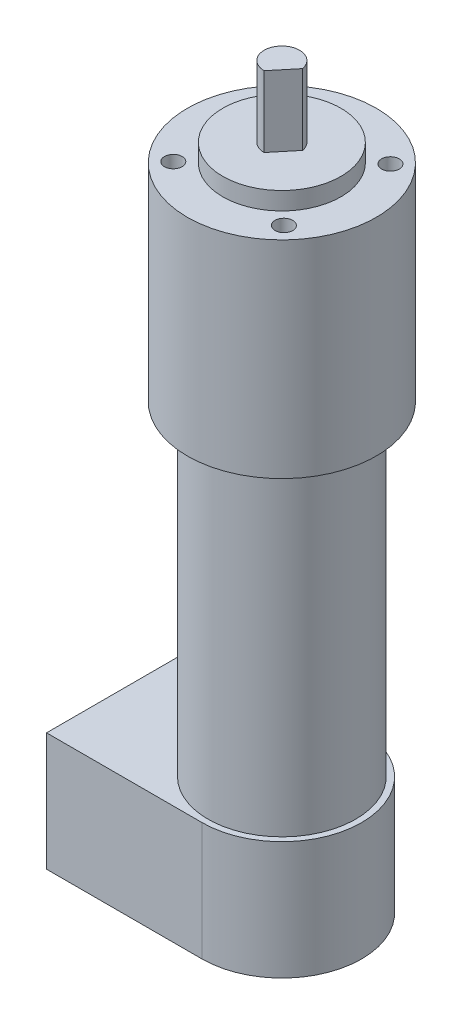
from build123d import *

# Parameters (mm, degrees)
ESQUISSE1_R             = 16
BOSS_EXTRU_1_DEPTH      = 35
ESQUISSE2_R             = 12.5
BOSS_EXTRU_2_DEPTH      = 55
ESQUISSE3_R             = 3
BOSS_EXTRU_3_DEPTH      = 15
ENL_V_START             = -15
ENL_V_MAT_EXTRU_1_DEPTH = 15
ESQUISSE5_R             = 10
BOSS_EXTRU_4_DEPTH      = 3
ESQUISSE8_R             = 1.5
ENL_V_MAT_EXTRU_2_DEPTH = 10
BOSS_EXTRU_5_DEPTH      = 20
ESQUISSE10_W            = 16.98090883
ESQUISSE10_H            = 7.182585406
ENL_V_MAT_EXTRU_3_DEPTH = 12
ESQUISSE12_W            = 1
ESQUISSE12_H            = 1
BOSS_EXTRU_6_DEPTH      = 12


with BuildPart() as part:
    # Esquisse1 → Boss.-Extru.1 (new body)
    with BuildSketch(Plane(origin=(0, 0, 0), x_dir=(1, 0, 0), z_dir=(0, 1, 0))):
        with Locations(Location((0, 0, 0), (0, 0, 270))):
            Circle(ESQUISSE1_R)
    extrude(amount=BOSS_EXTRU_1_DEPTH)

    # Esquisse2 → Boss.-Extru.2 (add)
    with BuildSketch(Plane.XZ):
        with Locations(Location((0, 0, 0), (0, 0, 270))):
            Circle(ESQUISSE2_R)
    extrude(amount=BOSS_EXTRU_2_DEPTH)

    # Esquisse3 → Boss.-Extru.3 (add)
    with BuildSketch(Plane(origin=(0, 35, 0), x_dir=(1, 0, 0), z_dir=(0, 1, 0))):
        with Locations(Location((0, 0, 0), (0, 0, 270))):
            Circle(ESQUISSE3_R)
    extrude(amount=BOSS_EXTRU_3_DEPTH)

    # Esquisse4 → Enlèv. mat.-Extru.1 (cut)
    with BuildSketch(Plane(origin=(0, 50, 0), x_dir=(1, 0, 0), z_dir=(0, 1, 0)).offset(ENL_V_START)):
        with BuildLine():
            Line((2.946395849, 0.56458082), (0, -3))
            ThreePointArc((0, -3), (2.31233026, -1.911315979), (2.946395849, 0.56458082))
        make_face()
    extrude(amount=ENL_V_MAT_EXTRU_1_DEPTH, mode=Mode.SUBTRACT)

    # Esquisse5 → Boss.-Extru.4 (add)
    with BuildSketch(Plane(origin=(0, 35, 0), x_dir=(1, 0, 0), z_dir=(0, 1, 0))):
        with Locations(Location((0, 0, 0), (0, 0, 270))):
            Circle(ESQUISSE5_R)
    extrude(amount=BOSS_EXTRU_4_DEPTH)

    # Esquisse8 → Enlèv. mat.-Extru.2 (cut)
    with BuildSketch(Plane(origin=(0, 35, 0), x_dir=(1, 0, 0), z_dir=(0, 1, 0))):
        with Locations(Location((-9.363786072, 9.017733108, 0), (0, 0, 270))):
            Circle(ESQUISSE8_R)
        with Locations(Location((9.363786072, 9.017733108, 0), (0, 0, 270))):
            Circle(ESQUISSE8_R)
        with Locations(Location((-9.363786072, -9.017733108, 0), (0, 0, 270))):
            Circle(ESQUISSE8_R)
        with Locations(Location((9.363786072, -9.017733108, 0), (0, 0, 270))):
            Circle(ESQUISSE8_R)
    extrude(amount=-ENL_V_MAT_EXTRU_2_DEPTH, mode=Mode.SUBTRACT)

    # Esquisse9 → Boss.-Extru.5 (add)
    with BuildSketch(Plane.XZ.offset(55)):
        with BuildLine():
            Line((0, 13.5), (-26.340367248, 13.5))
            Line((-26.340367248, 13.5), (-26.340367248, -13.5))
            Line((-26.340367248, -13.5), (0, -13.5))
            ThreePointArc((0, -13.5), (13.5, 0), (0, 13.5))
        make_face()
    extrude(amount=BOSS_EXTRU_5_DEPTH)

    # Esquisse10 → Enlèv. mat.-Extru.3 (cut)
    with BuildSketch(Plane.ZY.offset(26.340367248)):
        with Locations((0, -60.318042099)):
            Rectangle(ESQUISSE10_W, ESQUISSE10_H)
    extrude(amount=-ENL_V_MAT_EXTRU_3_DEPTH, mode=Mode.SUBTRACT)

    # Esquisse12 → Boss.-Extru.6 (add)
    with BuildSketch(Plane.ZY.offset(14.340367248)):
        with Locations((-1.990454415, -58.574860414)):
            Rectangle(ESQUISSE12_W, ESQUISSE12_H)
        with Locations((-3.990454415, -58.574860414)):
            Rectangle(ESQUISSE12_W, ESQUISSE12_H)
        with Locations((0.009545585, -58.574860414)):
            Rectangle(ESQUISSE12_W, ESQUISSE12_H)
        with Locations((2.009545585, -58.574860414)):
            Rectangle(ESQUISSE12_W, ESQUISSE12_H)
        with Locations((4.009545585, -58.574860414)):
            Rectangle(ESQUISSE12_W, ESQUISSE12_H)
    extrude(amount=BOSS_EXTRU_6_DEPTH)


solid = part.part
